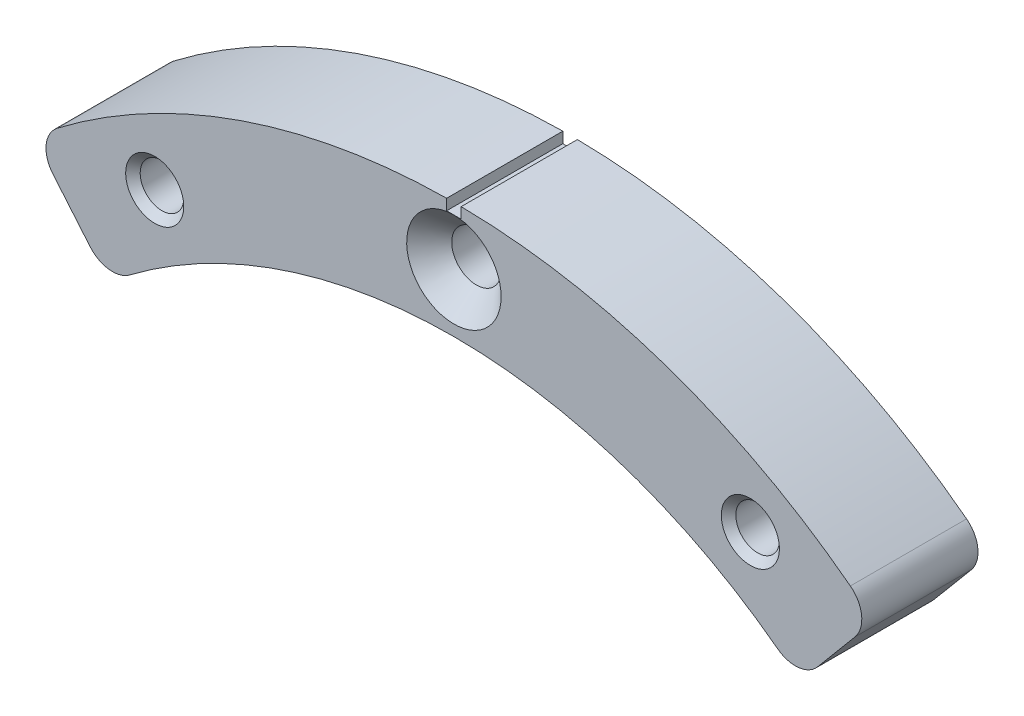
from build123d import *

# Parameters (mm, degrees)
EXTRUDE_1_DEPTH           = 8
HOLE_WIZARD_1_D           = 3.4
HOLE_WIZARD_1_DEPTH       = 10
HOLE_WIZARD_1_CSINK_D     = 6.5
HOLE_WIZARD_1_CSINK_ANGLE = 90
HOLE_WIZARD_1_TIP         = 1.021463052
FILLET_1_R                = 2
MM_2_D                    = 3
CHAMFER_1_SIZE            = 0.5
SKETCH_7_W                = 1
SKETCH_7_H                = 1.5
CUT_EXTRUDE_1_DEPTH       = 54.641089712


with BuildPart() as part:
    # 草图1 → 凸台-拉伸1 (new body)
    with BuildSketch(Plane.XY):
        with BuildLine():
            Line((-28.925442436, 34.47199994), (-23.783141558, 28.343644395))
            ThreePointArc((-23.783141558, 28.343644395), (0, 37), (23.783141558, 28.343644395))
            Line((23.783141558, 28.343644395), (28.925442436, 34.47199994))
            ThreePointArc((28.925442436, 34.47199994), (0, 45), (-28.925442436, 34.47199994))
        make_face()
    extrude(amount=EXTRUDE_1_DEPTH)

    # 打孔尺寸(%根据)内六角花形半沉头螺钉的类型1
    with Locations(Plane.XY.offset(8)):
        with Locations((0, 41)):
            CounterSinkHole(HOLE_WIZARD_1_D / 2, HOLE_WIZARD_1_CSINK_D / 2, depth=HOLE_WIZARD_1_DEPTH, counter_sink_angle=HOLE_WIZARD_1_CSINK_ANGLE)
            with Locations((0, 0, -(HOLE_WIZARD_1_DEPTH + HOLE_WIZARD_1_TIP / 2))):  # 118° drill point
                Cone(0, HOLE_WIZARD_1_D / 2, HOLE_WIZARD_1_TIP, mode=Mode.SUBTRACT)

    # 圆角1
    fillet_1_edges = [part.edges().sort_by_distance(p)[0] for p in [
        (-23.783141558, 28.343644395, 4),
        (-28.925442436, 34.47199994, 4),
        (28.925442436, 34.47199994, 4),
        (23.783141558, 28.343644395, 4),
    ]]
    fillet(fillet_1_edges, radius=FILLET_1_R)

    # 大小mm 暗销孔2 (through all)
    with Locations(Plane.XY.offset(8)):
        with Locations((20.406972636, 35.560588688), (-20.592886859, 35.453251061)):
            Hole(MM_2_D / 2)

    # 倒角1
    chamfer_1_edges = [part.edges().sort_by_distance(p)[0] for p in [
        (21.906972636, 35.560588688, 8),
        (-19.092886859, 35.453251061, 8),
    ]]
    chamfer(chamfer_1_edges, length=CHAMFER_1_SIZE)

    # 草图7 → 切除-拉伸1 (cut, through all)
    with BuildSketch(Plane.XY.offset(8)):
        with Locations((0, 45)):
            Rectangle(SKETCH_7_W, SKETCH_7_H)
    extrude(amount=-CUT_EXTRUDE_1_DEPTH, mode=Mode.SUBTRACT)


solid = part.part
